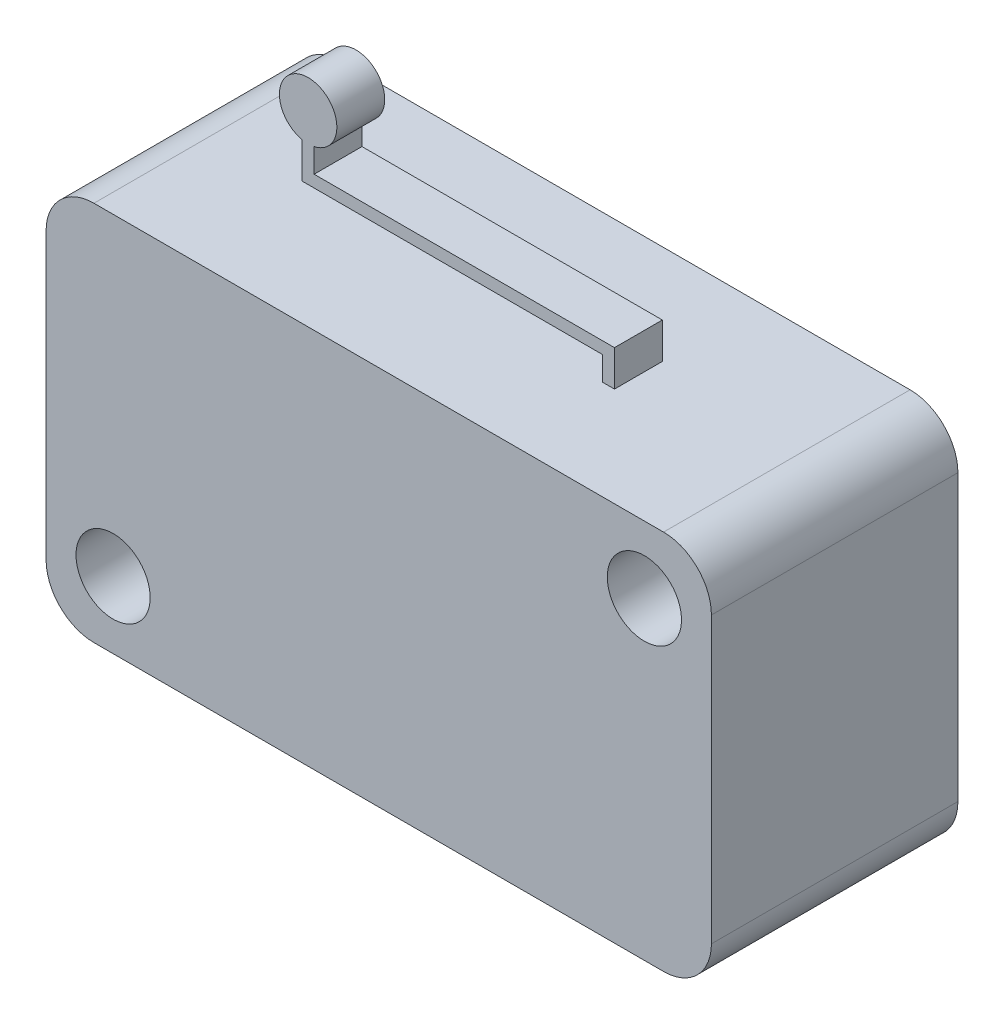
from build123d import *

# Parameters (mm, degrees)
SKETCH1_R                = 1.55
BOSS_EXTRUDE1_DEPTH      = 10.3
BOSS_EXTRUDE2_DEPTH      = 1
BOSS_EXTRUDE2_DEPTH_BACK = 1


with BuildPart() as part:
    # Sketch1 → Boss-Extrude1 (new body)
    with BuildSketch(Plane.XY):
        with BuildLine():
            Line((2, 0), (25.8, 0))
            ThreePointArc((25.8, 0), (27.214213562, 0.585786438), (27.8, 2))
            Line((27.8, 2), (27.8, 13.9))
            ThreePointArc((27.8, 13.9), (27.214213562, 15.314213562), (25.8, 15.9))
            Line((25.8, 15.9), (2, 15.9))
            ThreePointArc((2, 15.9), (0.585786438, 15.314213562), (0, 13.9))
            Line((0, 13.9), (0, 2))
            ThreePointArc((0, 2), (0.585786438, 0.585786438), (2, 0))
        make_face()
        with Locations(Location((2.8, 2.8, 0), (0, 0, 180))):
            Circle(SKETCH1_R, mode=Mode.SUBTRACT)
        with Locations(Location((25, 13.1, 0), (0, 0, 180))):
            Circle(SKETCH1_R, mode=Mode.SUBTRACT)
    extrude(amount=BOSS_EXTRUDE1_DEPTH)

    # Sketch2 → Boss-Extrude2 (add, two sides: drawn at the far end of the back side and taken through both)
    with BuildSketch(Plane.XY.offset(5.15).offset(-BOSS_EXTRUDE2_DEPTH_BACK)):
        with BuildLine():
            Line((6.55, 18.4), (6.55, 16.9))
            Line((6.55, 16.9), (7.05, 16.9))
            Line((7.05, 16.9), (19.1, 16.9))
            Line((19.1, 16.9), (19.1, 15.9))
            Line((19.1, 15.9), (19.6, 15.9))
            Line((19.6, 15.9), (19.6, 17.4))
            Line((19.6, 17.4), (7.05, 17.4))
            Line((7.05, 17.4), (7.05, 18.4))
            ThreePointArc((7.05, 18.4), (6.8, 20.773669459), (6.55, 18.4))
        make_face()
    extrude(amount=BOSS_EXTRUDE2_DEPTH + BOSS_EXTRUDE2_DEPTH_BACK)


solid = part.part
